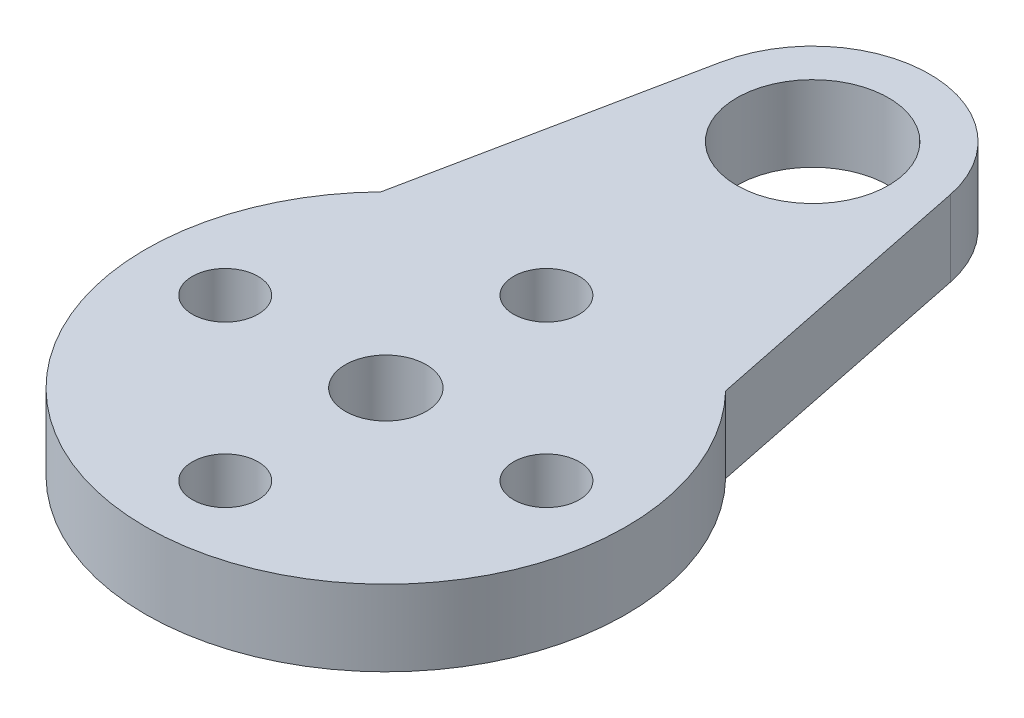
from build123d import *

# Parameters (mm, degrees)
SKETCH1_R           = 3
SKETCH1_R_2         = 1.6
BOSS_EXTRUDE1_DEPTH = 3
SKETCH2_R           = 1.3
CUT_EXTRUDE1_DEPTH  = 3
BOSS_EXTRUDE2_START = -3
BOSS_EXTRUDE2_DEPTH = 3


with BuildPart() as part:
    # Sketch1 → Boss-Extrude1 (new body)
    with BuildSketch(Plane(origin=(0, 0, 0), x_dir=(1, 0, 0), z_dir=(0, 1, 0))):
        with BuildLine():
            Line((-4.531642246, 17.7995776), (-7.838367177, 1.6))
            ThreePointArc((-7.838367177, 1.6), (0, -8), (7.838367177, 1.6))
            Line((7.838367177, 1.6), (4.531642246, 17.7995776))
            ThreePointArc((4.531642246, 17.7995776), (0, 21.499648), (-4.531642246, 17.7995776))
        make_face()
        with Locations(Location((0, 16.87456, 0), (0, 0, 270))):
            Circle(SKETCH1_R, mode=Mode.SUBTRACT)
        with Locations(Location((0, 0, 0), (0, 0, 270))):
            Circle(SKETCH1_R_2, mode=Mode.SUBTRACT)
    extrude(amount=BOSS_EXTRUDE1_DEPTH)

    # Sketch2 → Cut-Extrude1 (cut)
    with BuildSketch(Plane(origin=(0, 3, 0), x_dir=(1, 0, 0), z_dir=(0, 1, 0))):
        with Locations(Location((0, 6.35, 0), (0, 0, 270))):
            Circle(SKETCH2_R)
        with Locations(Location((6.35, 0, 0), (0, 0, 270))):
            Circle(SKETCH2_R)
        with Locations(Location((0, -6.35, 0), (0, 0, 270))):
            Circle(SKETCH2_R)
        with Locations(Location((-6.35, 0, 0), (0, 0, 270))):
            Circle(SKETCH2_R)
    extrude(amount=-CUT_EXTRUDE1_DEPTH, mode=Mode.SUBTRACT)

    # Sketch3 → Boss-Extrude2 (add)
    with BuildSketch(Plane(origin=(0, 3, 0), x_dir=(1, 0, 0), z_dir=(0, 1, 0)).offset(BOSS_EXTRUDE2_START)):
        with BuildLine():
            Line((-7.838367177, 1.6), (-6.8136721, 6.619960159))
            ThreePointArc((-6.8136721, 6.619960159), (0, -9.5), (6.8136721, 6.619960159))
            Line((6.8136721, 6.619960159), (7.838367177, 1.6))
            ThreePointArc((7.838367177, 1.6), (0, -8), (-7.838367177, 1.6))
        make_face()
    extrude(amount=BOSS_EXTRUDE2_DEPTH)


solid = part.part
